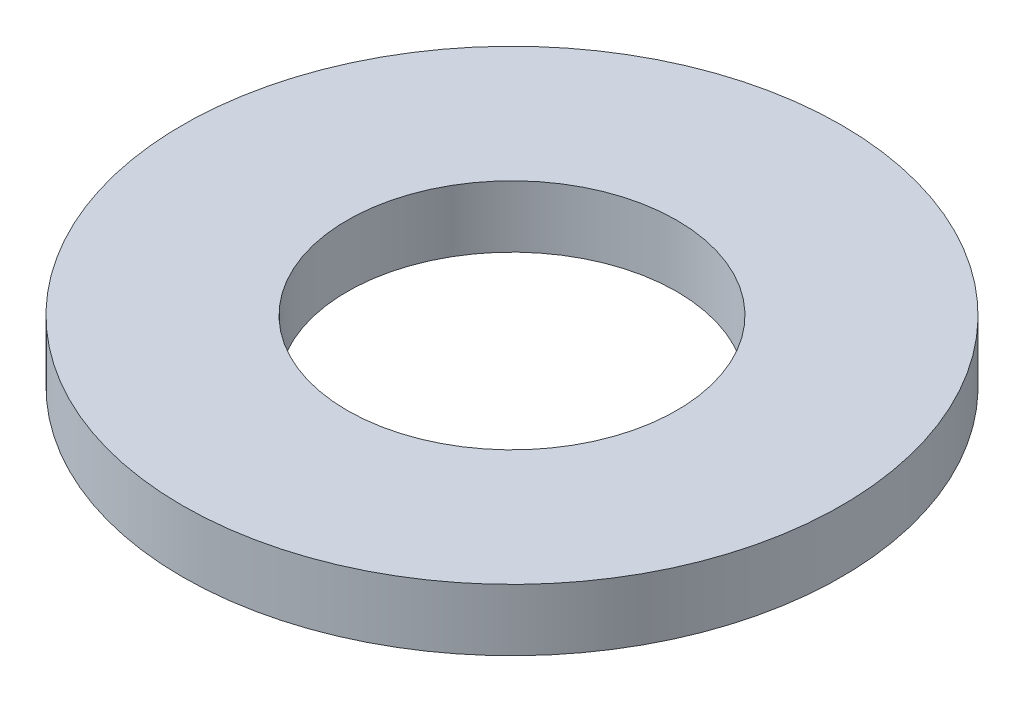
from build123d import *

# Parameters (mm, degrees)
SKETCH1_R           = 16
SKETCH1_R_2         = 8
BOSS_EXTRUDE1_DEPTH = 1.5


with BuildPart() as part:
    # Sketch1 → Boss-Extrude1 (new, symmetric)
    with BuildSketch(Plane(origin=(0, 0, 0), x_dir=(1, 0, 0), z_dir=(0, 1, 0))):
        with Locations(Location((0, 0, 0), (0, 0, 270))):
            Circle(SKETCH1_R)
        with Locations(Location((0, 0, 0), (0, 0, 270))):
            Circle(SKETCH1_R_2, mode=Mode.SUBTRACT)
    extrude(amount=BOSS_EXTRUDE1_DEPTH, both=True)


solid = part.part
